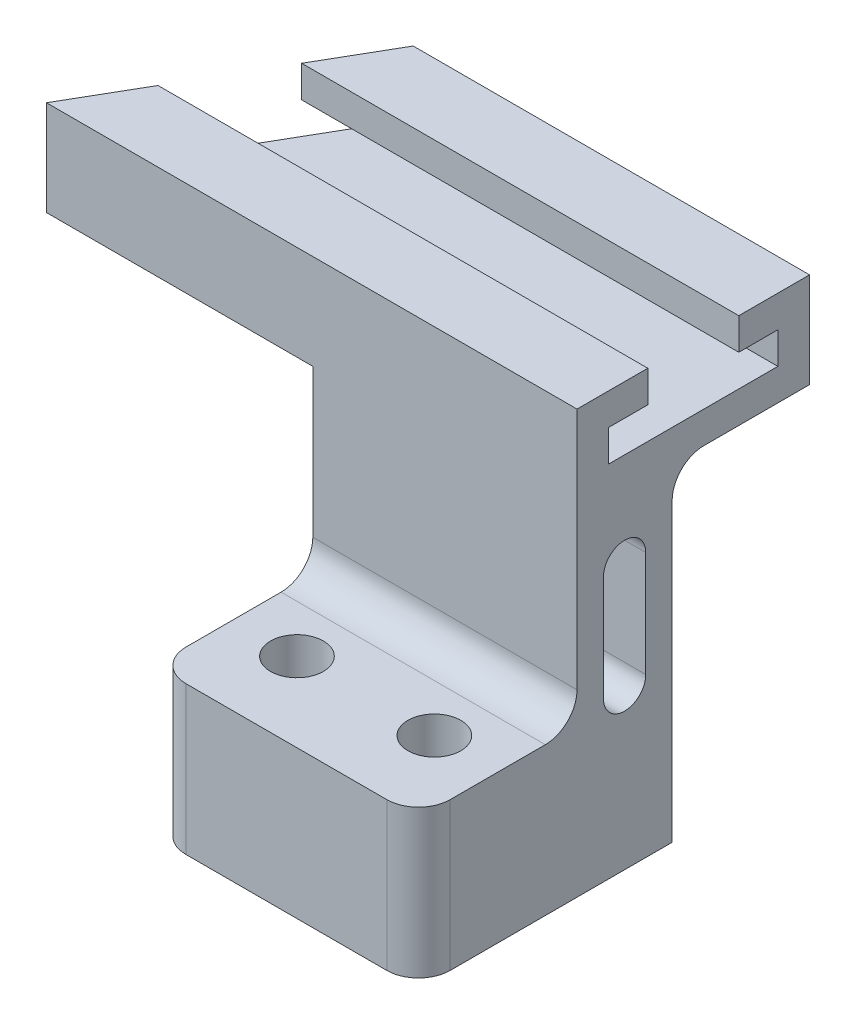
from build123d import *

# Parameters (mm, degrees)
BOSS_EXTRUDE1_DEPTH = 110
CUT_EXTRUDE1_DEPTH  = 155.841854807
SKETCH3_W           = 74.760259453
SKETCH3_H           = 62
CUT_EXTRUDE2_DEPTH  = 155.841854807
SKETCH4_R           = 5
CUT_EXTRUDE3_DEPTH  = 136.132694452
FILLET1_R           = 6


with BuildPart() as part:
    # Sketch1 → Boss-Extrude1 (new body)
    with BuildSketch(Plane(origin=(0, 0, 0), x_dir=(0, 0, -1), z_dir=(1, 0, 0))):
        with BuildLine():
            Line((0, 0), (48, 0))
            Line((48, 0), (48, 56))
            ThreePointArc((48, 56), (49.757359313, 60.242640687), (54, 62))
            Line((54, 62), (74, 62))
            Line((74, 62), (74, 80))
            Line((74, 80), (60.615384615, 80))
            Line((60.615384615, 80), (60.615384615, 74))
            Line((60.615384615, 74), (68, 74))
            Line((68, 74), (68, 68))
            Line((68, 68), (36, 68))
            Line((36, 68), (36, 74))
            Line((36, 74), (43.384615385, 74))
            Line((43.384615385, 74), (43.384615385, 80))
            Line((43.384615385, 80), (30, 80))
            Line((30, 80), (30, 34))
            ThreePointArc((30, 34), (28.242640687, 29.757359313), (24, 28))
            Line((24, 28), (0, 28))
            Line((0, 28), (0, 0))
        make_face()
        with BuildLine():
            Line((43, 50), (43, 30))
            ThreePointArc((43, 30), (39, 26), (35, 30))
            Line((35, 30), (35, 50))
            ThreePointArc((35, 50), (39, 54), (43, 50))
        make_face(mode=Mode.SUBTRACT)
    extrude(amount=-BOSS_EXTRUDE1_DEPTH)

    # Sketch2 → Cut-Extrude1 (cut, through all)
    with BuildSketch(Plane(origin=(0, 80, 0), x_dir=(1, 0, 0), z_dir=(0, 1, 0))):
        Polygon((-110, 74), (-110, 13.378221735), (-75, 74), align=None)
    extrude(amount=-CUT_EXTRUDE1_DEPTH, mode=Mode.SUBTRACT)

    # Sketch3 → Cut-Extrude2 (cut, through all)
    with BuildSketch(Plane.XY):
        with Locations((-87.380129727, 31)):
            Rectangle(SKETCH3_W, SKETCH3_H)
    extrude(amount=-CUT_EXTRUDE2_DEPTH, mode=Mode.SUBTRACT)

    # Sketch4 → Cut-Extrude3 (cut, through all)
    with BuildSketch(Plane(origin=(0, 28, 0), x_dir=(1, 0, 0), z_dir=(0, 1, 0))):
        with Locations(Location((-38, 15, 0), (0, 0, 270))):
            Circle(SKETCH4_R)
        with Locations(Location((-12, 15, 0), (0, 0, 270))):
            Circle(SKETCH4_R)
    extrude(amount=-CUT_EXTRUDE3_DEPTH, mode=Mode.SUBTRACT)

    # Fillet1
    fillet1_edges = [part.edges().sort_by_distance(p)[0] for p in [
        (-50, 14, 0),
        (0, 14, 0),
    ]]
    fillet(fillet1_edges, radius=FILLET1_R)


solid = part.part
